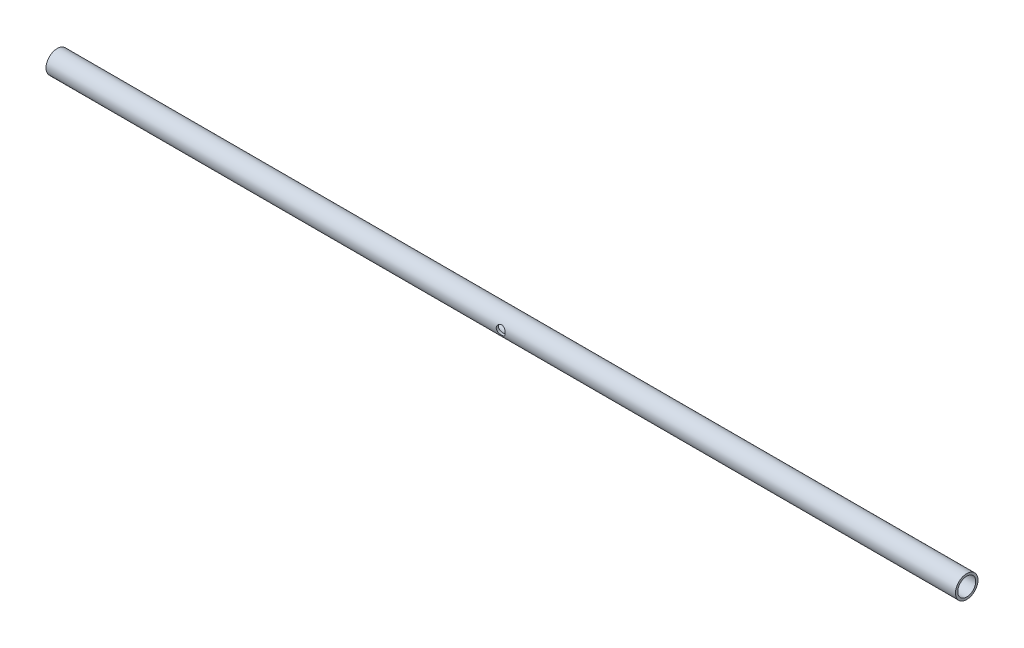
from build123d import *

# Parameters (mm, degrees)
SKETCH_1_R               = 5
SKETCH_1_R_2             = 4
EXTRUDE_1_DEPTH          = 201.975
CUT_EXTRUDE_1_DEPTH      = 203.098739791
CUT_EXTRUDE_1_DEPTH_BACK = 203.098739791
SKETCH_2_R               = 2


with BuildPart() as part:
    # 草圖1 → 填料-伸長1 (new, symmetric)
    with BuildSketch(Plane(origin=(0, 0, 0), x_dir=(0, 0, -1), z_dir=(1, 0, 0))):
        Circle(SKETCH_1_R)
        Circle(SKETCH_1_R_2, mode=Mode.SUBTRACT)
    extrude(amount=EXTRUDE_1_DEPTH, both=True)

    # 草圖2 → 除料-伸長1 (cut, two sides: drawn at the far end of the back side and taken through both)
    with BuildSketch(Plane.XY.offset(-CUT_EXTRUDE_1_DEPTH_BACK)):
        Circle(SKETCH_2_R)
    extrude(amount=CUT_EXTRUDE_1_DEPTH + CUT_EXTRUDE_1_DEPTH_BACK, mode=Mode.SUBTRACT)


solid = part.part
